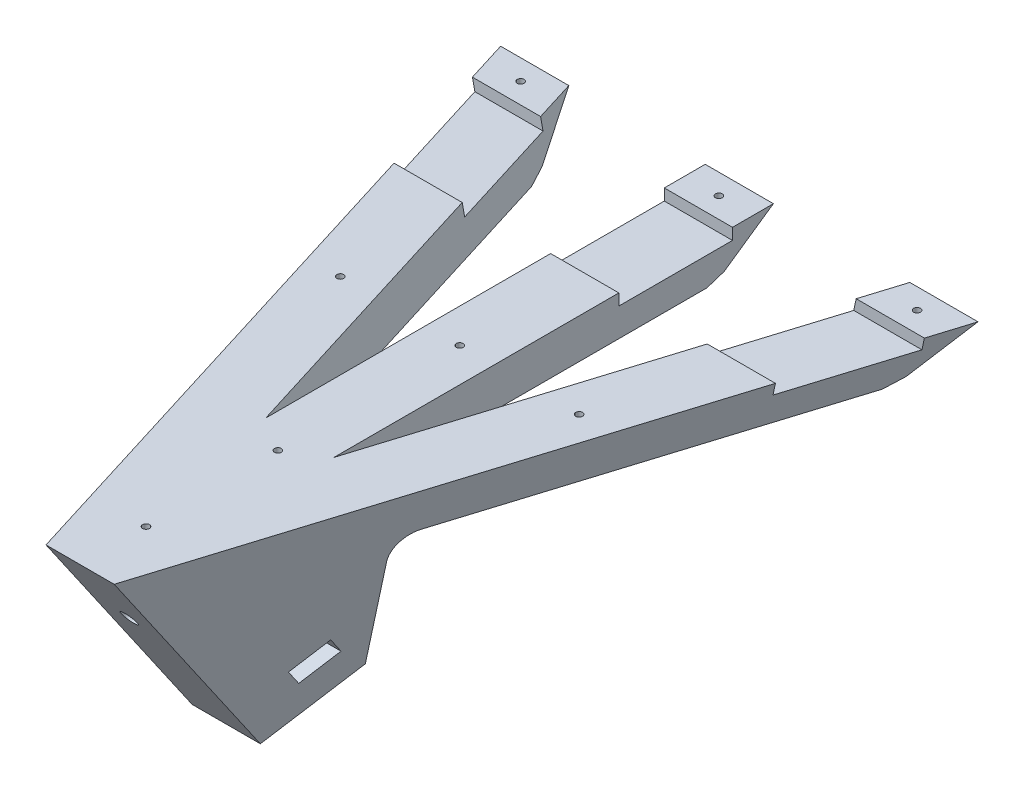
from build123d import *

# Parameters (mm, degrees)
CROQUIS2_W                  = 390
CROQUIS2_H                  = 290
SALIENTE_EXTRUIR2_DEPTH     = 10
CROQUIS3_W                  = 390
CROQUIS3_H                  = 7
SALIENTE_EXTRUIR3_DEPTH     = 25
SALIENTE_EXTRUIR4_DEPTH     = 390
CORTAR_EXTRUIR1_DEPTH       = 180
CORTAR_EXTRUIR2_DEPTH       = 180
SALIENTE_EXTRUIR5_DEPTH     = 179
CROQUIS10_W                 = 283
CROQUIS10_H                 = 194.109962813
CORTAR_EXTRUIR5_DEPTH       = 236
CORTAR_EXTRUIR6_DEPTH       = 236
SALIENTE_EXTRUIR6_DEPTH     = 236
CROQUIS13_W                 = 339.798946509
CROQUIS13_H                 = 236.819651801
CROQUIS13_W_2               = 44.776464784
CROQUIS13_H_2               = 75.104657821
CORTAR_EXTRUIR7_DEPTH       = 500
CROQUIS14_W                 = 59.446000687
CROQUIS14_H                 = 81.435889979
CORTAR_EXTRUIR8_DEPTH       = 500
CROQUIS15_W                 = 50
CROQUIS15_H                 = 5
CORTAR_EXTRUIR9_DEPTH       = 500
CROQUIS16_W                 = 390
CROQUIS16_H                 = 283
CORTAR_EXTRUIR10_DEPTH      = 10
CROQUIS17_R                 = 3.75
CORTAR_EXTRUIR11_DEPTH      = 10
CROQUIS18_R                 = 3.75
CROQUIS18_R_2               = 1.5
SALIENTE_EXTRUIR8_DEPTH     = 4
CROQUIS19_R                 = 1.5
SALIENTE_EXTRUIR10_DEPTH    = 15
CROQUIS20_R                 = 1.5
SALIENTE_EXTRUIR11_DEPTH    = 15
SALIENTE_EXTRUIR11_2_DEPTH  = 15
SALIENTE_EXTRUIR11_3_DEPTH  = 15
CROQUIS21_W                 = 390
CROQUIS21_H                 = 283
SALIENTE_EXTRUIR12_DEPTH    = 10
CORTAR_EXTRUIR12_START      = -47
CROQUIS22_R                 = 1.5
CORTAR_EXTRUIR12_DEPTH      = 47
CROQUIS26_W                 = 283
CROQUIS26_H                 = 4.5
CORTAR_EXTRUIR16_DEPTH      = 500
CROQUIS27_W                 = 7
CROQUIS27_H                 = 9.5
CORTAR_EXTRUIR17_DEPTH      = 500
CORTAR_EXTRUIR18_DEPTH      = 500
CROQUIS29_R                 = 3.5
CORTAR_EXTRUIR19_DEPTH      = 20
CORTAR_EXTRUIR20_DEPTH      = 314
CROQUIS32_R                 = 3.5
CORTAR_EXTRUIR21_DEPTH      = 25
CROQUIS33_W                 = 308.833685193
CROQUIS33_H                 = 37.038834889
CORTAR_EXTRUIR22_DEPTH      = 500
CROQUIS34_W                 = 390
CROQUIS34_H                 = 290
CROQUIS34_R                 = 1.5
SALIENTE_EXTRUIR14_DEPTH    = 5.5
CROQUIS35_W                 = 390
CROQUIS35_H                 = 10
SALIENTE_EXTRUIR15_DEPTH    = 22
CORTAR_EXTRUIR23_DEPTH      = 488
CORTAR_EXTRUIR28_DEPTH      = 479.5
CROQUIS38_R                 = 3.5
CORTAR_EXTRUIR29_DEPTH      = 25
CROQUIS39_R                 = 1.5
SALIENTE_EXTRUIR16_DEPTH    = 9
CROQUIS40_R                 = 3.5
SALIENTE_EXTRUIR17_DEPTH    = 25
CROQUIS41_R                 = 3.5
CORTAR_EXTRUIR30_DEPTH      = 25
CORTAR_EXTRUIR31_DEPTH      = 41
CORTAR_EXTRUIR31_DEPTH_BACK = 5.5
CROQUIS42_W                 = 390
CROQUIS42_H                 = 290


with BuildPart() as part:
    # Croquis2 → Saliente-Extruir2 (new body)
    with BuildSketch(Plane(origin=(0, 0, 0), x_dir=(1, 0, 0), z_dir=(0, 1, 0))):
        Rectangle(CROQUIS2_W, CROQUIS2_H)
    extrude(amount=SALIENTE_EXTRUIR2_DEPTH)

    # Croquis3 → Saliente-Extruir3 (add)
    with BuildSketch(Plane(origin=(0, 10, 0), x_dir=(1, 0, 0), z_dir=(0, 1, 0))):
        with Locations((0, -141.5)):
            Rectangle(CROQUIS3_W, CROQUIS3_H)
    extrude(amount=SALIENTE_EXTRUIR3_DEPTH)

    # Croquis5 → Saliente-Extruir4 (add)
    with BuildSketch(Plane.ZY.offset(195)):
        Polygon((145, 0), (51.120689647, -135.689627782), (-145, 0), align=None)
    extrude(amount=-SALIENTE_EXTRUIR4_DEPTH)

    # Croquis6 → Cortar-Extruir1 (cut)
    with BuildSketch(Plane.ZY.offset(195)):
        Polygon((-145, 0), (145, 0), (51.120689647, -135.689627782), align=None)
    extrude(amount=-CORTAR_EXTRUIR1_DEPTH, mode=Mode.SUBTRACT)

    # Croquis7 → Cortar-Extruir2 (cut)
    with BuildSketch(Plane(origin=(195, 0, 0), x_dir=(0, 0, -1), z_dir=(1, 0, 0))):
        Polygon((145, 0), (-145, 0), (-51.120689647, -135.689627782), align=None)
    extrude(amount=-CORTAR_EXTRUIR2_DEPTH, mode=Mode.SUBTRACT)

    # Croquis8 → Saliente-Extruir5 (add)
    with BuildSketch(Plane(origin=(0, -67.844813894, -46.939655172), x_dir=(-1, 0, 0), z_dir=(0, -0.8223613805318496, -0.5689655172413796))):
        Polygon((15, -119.242400168), (105, 119.242400177), (75, 119.242400177), (15, -39.747466719), align=None)
    extrude(amount=-SALIENTE_EXTRUIR5_DEPTH)

    # Croquis10 → Cortar-Extruir5 (cut)
    with BuildSketch(Plane.ZY.offset(195)):
        with Locations((-3.5, 107.054981407)):
            Rectangle(CROQUIS10_W, CROQUIS10_H)
    extrude(amount=-CORTAR_EXTRUIR5_DEPTH, mode=Mode.SUBTRACT)

    # Croquis11 → Cortar-Extruir6 (cut)
    with BuildSketch(Plane.ZY.offset(195)):
        Polygon((145, 17.024145748), (144.999999988, 0), (165.789590248, 1.603195777), (161.358166331, 19.30887792), align=None)
    extrude(amount=-CORTAR_EXTRUIR6_DEPTH, mode=Mode.SUBTRACT)

    # Croquis12 → Saliente-Extruir6 (add)
    with BuildSketch(Plane(origin=(0, -67.844813894, -46.939655172), x_dir=(-1, 0, 0), z_dir=(0, -0.8223613805318496, -0.5689655172413796))):
        Polygon((-15, -119.242400168), (-105, 119.242400177), (-75, 119.242400177), (-15, -39.747466719), align=None)
    extrude(amount=-SALIENTE_EXTRUIR6_DEPTH)

    # Croquis13 → Cortar-Extruir7 (cut)
    with BuildSketch(Plane(origin=(195, 0, 0), x_dir=(0, 0, -1), z_dir=(1, 0, 0))):
        with Locations((31.899473255, 128.409825901)):
            Rectangle(CROQUIS13_W, CROQUIS13_H)
        with Locations((-167.388232392, 37.552328911)):
            Rectangle(CROQUIS13_W_2, CROQUIS13_H_2)
    extrude(amount=-CORTAR_EXTRUIR7_DEPTH, mode=Mode.SUBTRACT)

    # Croquis14 → Cortar-Extruir8 (cut)
    with BuildSketch(Plane(origin=(195, 0, 0), x_dir=(0, 0, -1), z_dir=(1, 0, 0))):
        with Locations((-167.723000344, 75.71794499)):
            Rectangle(CROQUIS14_W, CROQUIS14_H)
    extrude(amount=-CORTAR_EXTRUIR8_DEPTH, mode=Mode.SUBTRACT)

    # Croquis15 → Cortar-Extruir9 (cut)
    with BuildSketch(Plane.ZY.offset(195)):
        with Locations((-102, -2.5)):
            Rectangle(CROQUIS15_W, CROQUIS15_H)
    extrude(amount=-CORTAR_EXTRUIR9_DEPTH, mode=Mode.SUBTRACT)

    # Croquis16 → Cortar-Extruir10 (cut)
    with BuildSketch(Plane(origin=(0, 10, 0), x_dir=(1, 0, 0), z_dir=(0, 1, 0))):
        with Locations((0, 3.5)):
            Rectangle(CROQUIS16_W, CROQUIS16_H)
    extrude(amount=-CORTAR_EXTRUIR10_DEPTH, mode=Mode.SUBTRACT)

    # Croquis17 → Cortar-Extruir11 (cut)
    with BuildSketch(Plane(origin=(0, 0, 0), x_dir=(1, 0, 0), z_dir=(0, 1, 0))):
        with Locations(Location((-87.205, 136, 0), (0, 0, 270))):
            Circle(CROQUIS17_R)
        with Locations(Location((0, 136, 0), (0, 0, 270))):
            Circle(CROQUIS17_R)
        with Locations(Location((87.205, 136, 0), (0, 0, 270))):
            Circle(CROQUIS17_R)
    extrude(amount=-CORTAR_EXTRUIR11_DEPTH, mode=Mode.SUBTRACT)

    # Croquis18 → Saliente-Extruir8 (add)
    # profile 1 of 3: a face of its own
    with BuildSketch(Plane(origin=(0, 0, 0), x_dir=(1, 0, 0), z_dir=(0, 1, 0))):
        with Locations((-87.205, 136)):
            Circle(CROQUIS18_R)
        with Locations(Location((-87.205, 136, 0), (0, 0, 270))):
            Circle(CROQUIS18_R_2, mode=Mode.SUBTRACT)
    # profile 2 of 3: a face of its own
    with BuildSketch(Plane(origin=(0, 0, 0), x_dir=(1, 0, 0), z_dir=(0, 1, 0))):
        with Locations((0, 136)):
            Circle(CROQUIS18_R)
        with Locations(Location((0, 136, 0), (0, 0, 270))):
            Circle(CROQUIS18_R_2, mode=Mode.SUBTRACT)
    # profile 3 of 3: a face of its own
    with BuildSketch(Plane(origin=(0, 0, 0), x_dir=(1, 0, 0), z_dir=(0, 1, 0))):
        with Locations((87.205, 136)):
            Circle(CROQUIS18_R)
        with Locations(Location((87.205, 136, 0), (0, 0, 270))):
            Circle(CROQUIS18_R_2, mode=Mode.SUBTRACT)
    extrude(amount=-SALIENTE_EXTRUIR8_DEPTH)

    # Croquis19 → Saliente-Extruir10 (add)
    with BuildSketch(Plane(origin=(0, 0, 0), x_dir=(1, 0, 0), z_dir=(0, 1, 0))):
        with Locations(Location((-52.533337706, 22, 0), (0, 0, 270))):
            Circle(CROQUIS19_R)
        with Locations(Location((0, 22, 0), (0, 0, 270))):
            Circle(CROQUIS19_R)
        with Locations(Location((52.533337706, 22, 0), (0, 0, 270))):
            Circle(CROQUIS19_R)
        with Locations(Location((0, -58, 0), (0, 0, 270))):
            Circle(CROQUIS19_R)
        with Locations(Location((0, -116, 0), (0, 0, 270))):
            Circle(CROQUIS19_R)
    extrude(amount=SALIENTE_EXTRUIR10_DEPTH)



with BuildPart() as body_2:
    # Croquis20 → Saliente-Extruir11 (new body)
    with BuildSketch(Plane(origin=(0, 0, 0), x_dir=(1, 0, 0), z_dir=(0, 1, 0))):
        with Locations(Location((-87.205, 136, 0), (0, 0, 270))):
            Circle(CROQUIS20_R)
    extrude(amount=SALIENTE_EXTRUIR11_DEPTH)


with BuildPart() as body_3:
    # Croquis20 → Saliente-Extruir11 2 (new body)
    with BuildSketch(Plane(origin=(0, 0, 0), x_dir=(1, 0, 0), z_dir=(0, 1, 0))):
        with Locations(Location((0, 136, 0), (0, 0, 270))):
            Circle(CROQUIS20_R)
    extrude(amount=SALIENTE_EXTRUIR11_2_DEPTH)


with BuildPart() as body_4:
    # Croquis20 → Saliente-Extruir11 3 (new body)
    with BuildSketch(Plane(origin=(0, 0, 0), x_dir=(1, 0, 0), z_dir=(0, 1, 0))):
        with Locations(Location((87.205, 136, 0), (0, 0, 270))):
            Circle(CROQUIS20_R)
    extrude(amount=SALIENTE_EXTRUIR11_3_DEPTH)


with BuildPart() as part_1:
    add(part.part)

    add(body_2.part)  # Saliente-Extruir12 merges body 2

    add(body_3.part)  # Saliente-Extruir12 merges body 3

    add(body_4.part)  # Saliente-Extruir12 merges body 4
    # Croquis21 → Saliente-Extruir12 (add)
    with BuildSketch(Plane(origin=(0, 0, 0), x_dir=(1, 0, 0), z_dir=(0, 1, 0))):
        with Locations((0, 3.5)):
            Rectangle(CROQUIS21_W, CROQUIS21_H)
    extrude(amount=SALIENTE_EXTRUIR12_DEPTH)

    # Croquis22 → Cortar-Extruir12 (cut)
    with BuildSketch(Plane(origin=(0, 15, 0), x_dir=(1, 0, 0), z_dir=(0, 1, 0)).offset(CORTAR_EXTRUIR12_START)):
        with Locations(Location((0, -116, 0), (0, 0, 270))):
            Circle(CROQUIS22_R)
        with Locations(Location((0, -58, 0), (0, 0, 270))):
            Circle(CROQUIS22_R)
        with Locations(Location((-52.533337706, 22, 0), (0, 0, 270))):
            Circle(CROQUIS22_R)
        with Locations(Location((0, 22, 0), (0, 0, 270))):
            Circle(CROQUIS22_R)
        with Locations(Location((52.533337706, 22, 0), (0, 0, 270))):
            Circle(CROQUIS22_R)
        with Locations(Location((87.205, 136, 0), (0, 0, 270))):
            Circle(CROQUIS22_R)
        with Locations(Location((0, 136, 0), (0, 0, 270))):
            Circle(CROQUIS22_R)
        with Locations(Location((-87.205, 136, 0), (0, 0, 270))):
            Circle(CROQUIS22_R)
    extrude(amount=CORTAR_EXTRUIR12_DEPTH, mode=Mode.SUBTRACT)

    # Croquis26 → Cortar-Extruir16 (cut)
    with BuildSketch(Plane.ZY.offset(195)):
        with Locations((-3.5, 7.75)):
            Rectangle(CROQUIS26_W, CROQUIS26_H)
    extrude(amount=-CORTAR_EXTRUIR16_DEPTH, mode=Mode.SUBTRACT)

    # Croquis27 → Cortar-Extruir17 (cut)
    with BuildSketch(Plane.ZY.offset(195)):
        with Locations((141.5, 30.25)):
            Rectangle(CROQUIS27_W, CROQUIS27_H)
    extrude(amount=-CORTAR_EXTRUIR17_DEPTH, mode=Mode.SUBTRACT)

    # Croquis28 → Cortar-Extruir18 (cut)
    with BuildSketch(Plane.ZY.offset(195)):
        Polygon((51.120689647, -135.689627782), (80.706896544, -92.926835995), (49.045983393, -71.021663581), (19.459776497, -113.784455368), align=None)
    extrude(amount=-CORTAR_EXTRUIR18_DEPTH, mode=Mode.SUBTRACT)

    # Croquis29 → Cortar-Extruir19 (cut)
    with BuildSketch(Plane(origin=(0, -25.082022106, -17.353448276), x_dir=(-1, 0, 0), z_dir=(0, -0.8223613805318496, -0.5689655172413796))):
        with Locations(Location((0, -91.242400168, 0), (0, 0, 90))):
            Circle(CROQUIS29_R)
    extrude(amount=-CORTAR_EXTRUIR19_DEPTH, mode=Mode.SUBTRACT)

    # Croquis31 → Cortar-Extruir20 (cut)
    with BuildSketch(Plane(origin=(195, 0, 0), x_dir=(0, 0, -1), z_dir=(1, 0, 0))):
        Polygon((-71.450630314, -70.714586325), (-76.002354452, -64.13569528), (-63.255753053, -55.316729763), (-58.704028915, -61.895620807), align=None)
    extrude(amount=-CORTAR_EXTRUIR20_DEPTH, mode=Mode.SUBTRACT)

    # Croquis32 → Cortar-Extruir21 (cut)
    with BuildSketch(Plane(origin=(0, -67.844813897, 98.06034482), x_dir=(1, 0, 0), z_dir=(0, -0.568965517289267, 0.8223613804987178))):
        with Locations(Location((0, 47.5, 0), (0, 0, 270))):
            Circle(CROQUIS32_R)
    extrude(amount=-CORTAR_EXTRUIR21_DEPTH, mode=Mode.SUBTRACT)

    # Croquis33 → Cortar-Extruir22 (cut)
    with BuildSketch(Plane(origin=(195, 0, 0), x_dir=(0, 0, -1), z_dir=(1, 0, 0))):
        with Locations((9.416842597, 18.519417445)):
            Rectangle(CROQUIS33_W, CROQUIS33_H)
    extrude(amount=-CORTAR_EXTRUIR22_DEPTH, mode=Mode.SUBTRACT)

    # Croquis34 → Saliente-Extruir14 (add)
    with BuildSketch(Plane(origin=(0, 0, 0), x_dir=(1, 0, 0), z_dir=(0, 1, 0))):
        Rectangle(CROQUIS34_W, CROQUIS34_H)
        with Locations(Location((0, -58, 0), (0, 0, 270))):
            Circle(CROQUIS34_R, mode=Mode.SUBTRACT)
        with Locations(Location((0, -116, 0), (0, 0, 270))):
            Circle(CROQUIS34_R, mode=Mode.SUBTRACT)
        with Locations(Location((-52.533337706, 22, 0), (0, 0, 270))):
            Circle(CROQUIS34_R, mode=Mode.SUBTRACT)
        with Locations(Location((0, 22, 0), (0, 0, 270))):
            Circle(CROQUIS34_R, mode=Mode.SUBTRACT)
        with Locations(Location((52.533337706, 22, 0), (0, 0, 270))):
            Circle(CROQUIS34_R, mode=Mode.SUBTRACT)
        with Locations(Location((-87.205, 136, 0), (0, 0, 270))):
            Circle(CROQUIS34_R, mode=Mode.SUBTRACT)
        with Locations(Location((0, 136, 0), (0, 0, 270))):
            Circle(CROQUIS34_R, mode=Mode.SUBTRACT)
        with Locations(Location((87.205, 136, 0), (0, 0, 270))):
            Circle(CROQUIS34_R, mode=Mode.SUBTRACT)
    extrude(amount=SALIENTE_EXTRUIR14_DEPTH)

    # Croquis35 → Saliente-Extruir15 (add)
    with BuildSketch(Plane(origin=(0, 5.5, 0), x_dir=(1, 0, 0), z_dir=(0, 1, 0))):
        with Locations((0, -140)):
            Rectangle(CROQUIS35_W, CROQUIS35_H)
    extrude(amount=SALIENTE_EXTRUIR15_DEPTH)

    # Croquis36 → Cortar-Extruir23 (cut)
    with BuildSketch(Plane.ZY.offset(195)):
        Polygon((19.459776497, -113.784455368), (-123.319563604, -15), (49.045983393, -71.021663581), align=None)
    extrude(amount=-CORTAR_EXTRUIR23_DEPTH, mode=Mode.SUBTRACT)

    # Croquis37 → Cortar-Extruir28 (cut)
    with BuildSketch(Plane.ZY.offset(195)):
        with BuildLine():
            Line((-115.772134461, -17.453039739), (39.045983393, -17.453039739))
            ThreePointArc((39.045983393, -17.453039739), (46.117051205, -20.381971927), (49.045983393, -27.453039739))
            Line((49.045983393, -27.453039739), (49.045983393, -71.021663581))
            Line((49.045983393, -71.021663581), (-115.772134461, -17.453039739))
        make_face()
    extrude(amount=-CORTAR_EXTRUIR28_DEPTH, mode=Mode.SUBTRACT)

    # Croquis38 → Cortar-Extruir29 (cut)
    with BuildSketch(Plane(origin=(0, -67.844813897, 98.06034482), x_dir=(1, 0, 0), z_dir=(0, -0.568965517289267, 0.8223613804987178))):
        with Locations((0, 44.5)):
            Circle(CROQUIS38_R)
    extrude(amount=-CORTAR_EXTRUIR29_DEPTH, mode=Mode.SUBTRACT)

    # Croquis39 → Saliente-Extruir16 (add)
    with BuildSketch(Plane(origin=(0, -32, 0), x_dir=(1, 0, 0), z_dir=(0, 1, 0))):
        with Locations(Location((0, -116, 0), (0, 0, 270))):
            Circle(CROQUIS39_R)
    extrude(amount=SALIENTE_EXTRUIR16_DEPTH)

    # Croquis40 → Saliente-Extruir17 (add)
    with BuildSketch(Plane(origin=(0, -67.844813897, 98.06034482), x_dir=(1, 0, 0), z_dir=(0, -0.568965517289267, 0.8223613804987178))):
        with Locations((0, 47.5)):
            Circle(CROQUIS40_R)
    extrude(amount=-SALIENTE_EXTRUIR17_DEPTH)

    # Croquis41 → Cortar-Extruir30 (cut)
    with BuildSketch(Plane(origin=(0, -67.844813897, 98.06034482), x_dir=(1, 0, 0), z_dir=(0, -0.568965517289267, 0.8223613804987178))):
        with Locations(Location((0, 44.5, 0), (0, 0, 270))):
            Circle(CROQUIS41_R)
    extrude(amount=-CORTAR_EXTRUIR30_DEPTH, mode=Mode.SUBTRACT)

    # Croquis42 → Cortar-Extruir31 (cut, two sides: drawn at the far end of the back side and taken through both)
    with BuildSketch(Plane(origin=(0, 5.5, 0), x_dir=(1, 0, 0), z_dir=(0, 1, 0)).offset(-CORTAR_EXTRUIR31_DEPTH_BACK)):
        Rectangle(CROQUIS42_W, CROQUIS42_H)
    extrude(amount=CORTAR_EXTRUIR31_DEPTH + CORTAR_EXTRUIR31_DEPTH_BACK, mode=Mode.SUBTRACT)


solid = part_1.part
